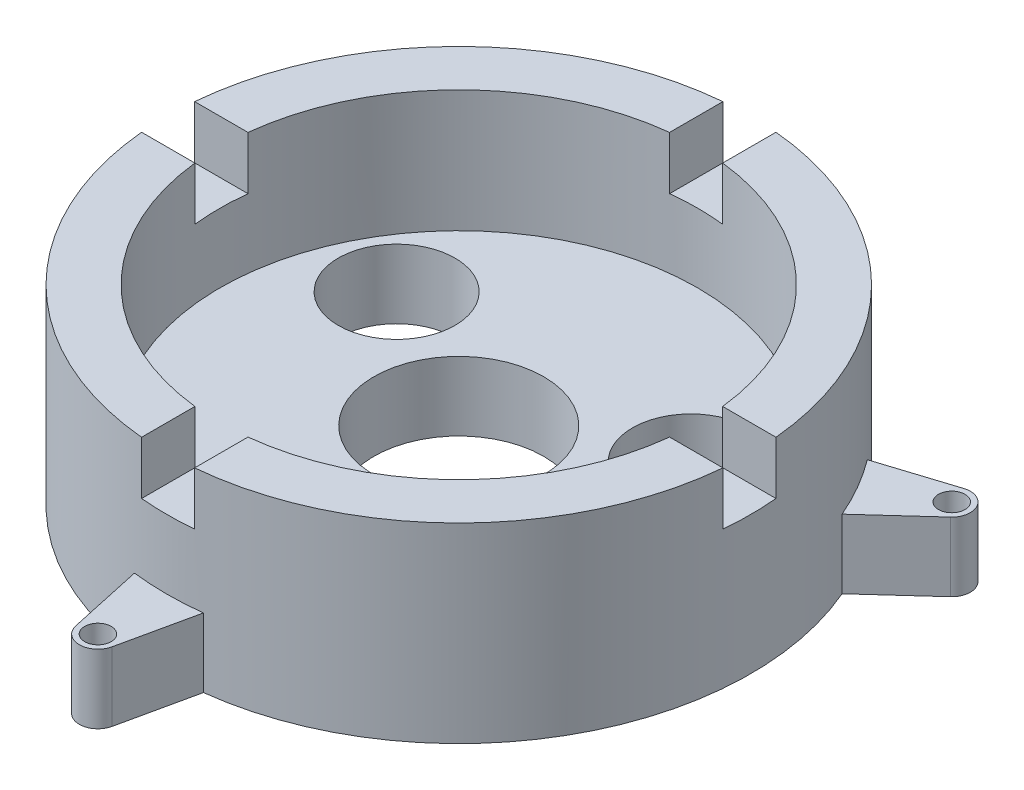
from build123d import *

# Parameters (mm, degrees)
CUT_EXTRUDE1_DEPTH  = 10
CIRPATTERN1_COUNT   = 4
SKETCH3_R           = 11
CUT_EXTRUDE2_DEPTH  = 82.111035008
CIRPATTERN2_COUNT   = 3
SKETCH5_R           = 2.5
BOSS_EXTRUDE1_DEPTH = 13
CIRPATTERN3_COUNT   = 3


with BuildPart() as part:
    # Sketch1 → Revolve2 (revolve)
    with BuildSketch(Plane.XY, mode=Mode.PRIVATE) as revolve2_sk:
        Polygon((16, 0), (16, 13), (45, 13), (45, 36), (55, 36), (55, 0), align=None)
    revolve(revolve2_sk.sketch.rotate(Axis((0, 0, 0), (0, 1, 0)), 90), axis=Axis((0, 0, 0), (0, 1, 0)))

    # Sketch2 → Cut-Extrude1 (cut)
    with BuildSketch(Plane(origin=(0, 36, 0), x_dir=(1, 0, 0), z_dir=(0, 1, 0))):
        with BuildLine():
            Line((44.72135955, 5), (54.772255751, 5))
            ThreePointArc((54.772255751, 5), (55, 0), (54.772255751, -5))
            Line((54.772255751, -5), (44.72135955, -5))
            ThreePointArc((44.72135955, -5), (45, 0), (44.72135955, 5))
        make_face()
    cut_extrude1 = extrude(amount=-CUT_EXTRUDE1_DEPTH, mode=Mode.SUBTRACT)

    # CirPattern1: Cut-Extrude1 ×4 about axis
    cirpattern1_axis = Axis((0, 0, 0), (0, 1, 0))
    for i in range(1, CIRPATTERN1_COUNT):
        add(cut_extrude1.rotate(cirpattern1_axis, i * 360 / CIRPATTERN1_COUNT), mode=Mode.SUBTRACT)

    # Sketch3 → Cut-Extrude2 (cut, through all)
    with BuildSketch(Plane(origin=(0, 13, 0), x_dir=(1, 0, 0), z_dir=(0, 1, 0))):
        with Locations(Location((0, -32, 0), (0, 0, 270))):
            Circle(SKETCH3_R)
    cut_extrude2 = extrude(amount=-CUT_EXTRUDE2_DEPTH, mode=Mode.SUBTRACT)

    # CirPattern2: Cut-Extrude2 ×3 about axis
    cirpattern2_axis = Axis((0, 0, 0), (0, 1, 0))
    for i in range(1, CIRPATTERN2_COUNT):
        add(cut_extrude2.rotate(cirpattern2_axis, i * 360 / CIRPATTERN2_COUNT), mode=Mode.SUBTRACT)

    # Sketch5 → Boss-Extrude1 (add)
    with BuildSketch(Plane.XZ):
        with BuildLine():
            Line((-6.5, 54.614558499), (-3.419696086, 68.745438584))
            ThreePointArc((-3.419696086, 68.745438584), (0, 71.5), (3.419696086, 68.745438584))
            Line((3.419696086, 68.745438584), (6.5, 54.614558499))
            ThreePointArc((6.5, 54.614558499), (0, 55), (-6.5, 54.614558499))
        make_face()
        with Locations(Location((0, 68, 0), (0, 0, 270))):
            Circle(SKETCH5_R, mode=Mode.SUBTRACT)
    boss_extrude1 = extrude(amount=-BOSS_EXTRUDE1_DEPTH)

    # CirPattern3: Boss-Extrude1 ×3 about axis
    cirpattern3_axis = Axis((0, 0, 0), (0, 1, 0))
    for i in range(1, CIRPATTERN3_COUNT):
        add(boss_extrude1.rotate(cirpattern3_axis, i * 360 / CIRPATTERN3_COUNT))


solid = part.part
